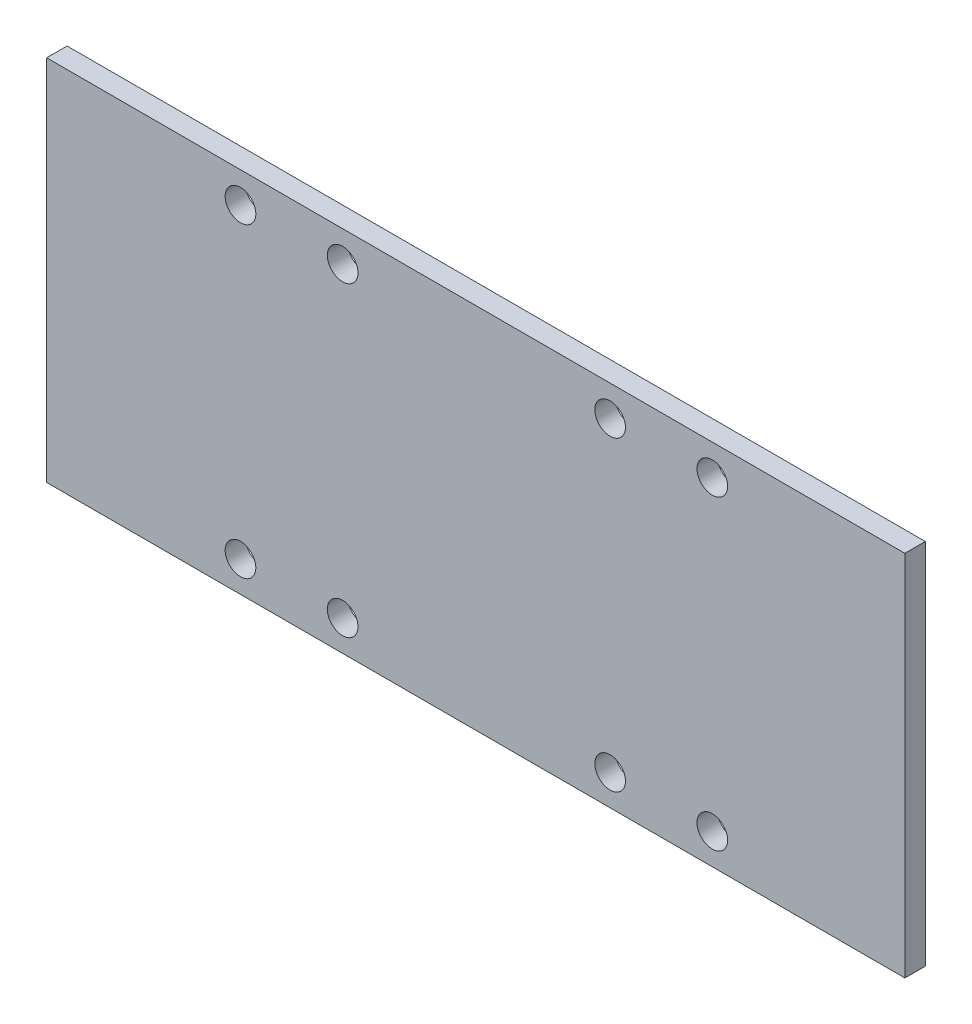
from build123d import *

# Parameters (mm, degrees)
SKETCH_1_W          = 84
SKETCH_1_H          = 36
EXTRUDE_1_DEPTH     = 2
SKETCH_2_R          = 1.5
CUT_EXTRUDE_1_DEPTH = 2


with BuildPart() as part:
    # 草图1 → 凸台-拉伸1 (new body)
    with BuildSketch(Plane.XY):
        Rectangle(SKETCH_1_W, SKETCH_1_H)
    extrude(amount=EXTRUDE_1_DEPTH)

    # 草图2 → 切除-拉伸1 (cut)
    with BuildSketch(Plane.XY.offset(2)):
        with Locations((23.15, -15)):
            Circle(SKETCH_2_R)
        with Locations((13.15, -15)):
            Circle(SKETCH_2_R)
        with Locations((-13.03, -15)):
            Circle(SKETCH_2_R)
        with Locations((-23.03, -15)):
            Circle(SKETCH_2_R)
        with Locations(Location((-23.03, 15, 0), (0, 0, 180))):
            Circle(SKETCH_2_R)
        with Locations(Location((-13.03, 15, 0), (0, 0, 180))):
            Circle(SKETCH_2_R)
        with Locations(Location((13.15, 15, 0), (0, 0, 180))):
            Circle(SKETCH_2_R)
        with Locations(Location((23.15, 15, 0), (0, 0, 180))):
            Circle(SKETCH_2_R)
    extrude(amount=-CUT_EXTRUDE_1_DEPTH, mode=Mode.SUBTRACT)


solid = part.part
